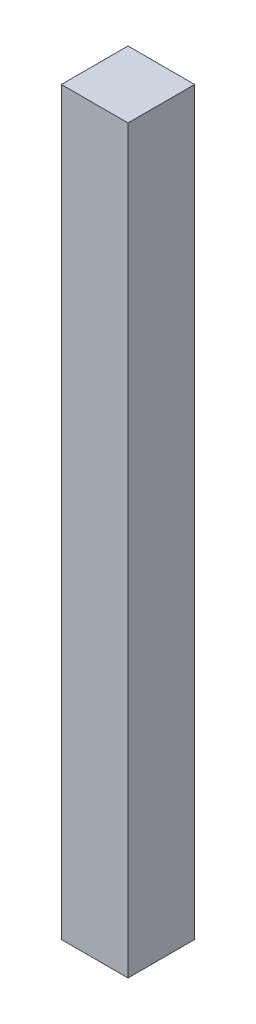
from build123d import *

# Parameters (mm, degrees)
STORE_KLAPE_KASET_KATI_GAZLI_AMORTISOR_2_START = -12
SKETCH1_W                                      = 18
SKETCH1_H                                      = 200
STORE_KLAPE_KASET_KATI_GAZLI_AMORTISOR_2_DEPTH = 18


with BuildPart() as part:
    # Sketch1 → STORE_klape_kaset_kati_gazli_amortisor_2_1 (new body)
    with BuildSketch(Plane.XY.offset(STORE_KLAPE_KASET_KATI_GAZLI_AMORTISOR_2_START)):
        with Locations((663, 536)):
            Rectangle(SKETCH1_W, SKETCH1_H)
    extrude(amount=-STORE_KLAPE_KASET_KATI_GAZLI_AMORTISOR_2_DEPTH)


solid = part.part
